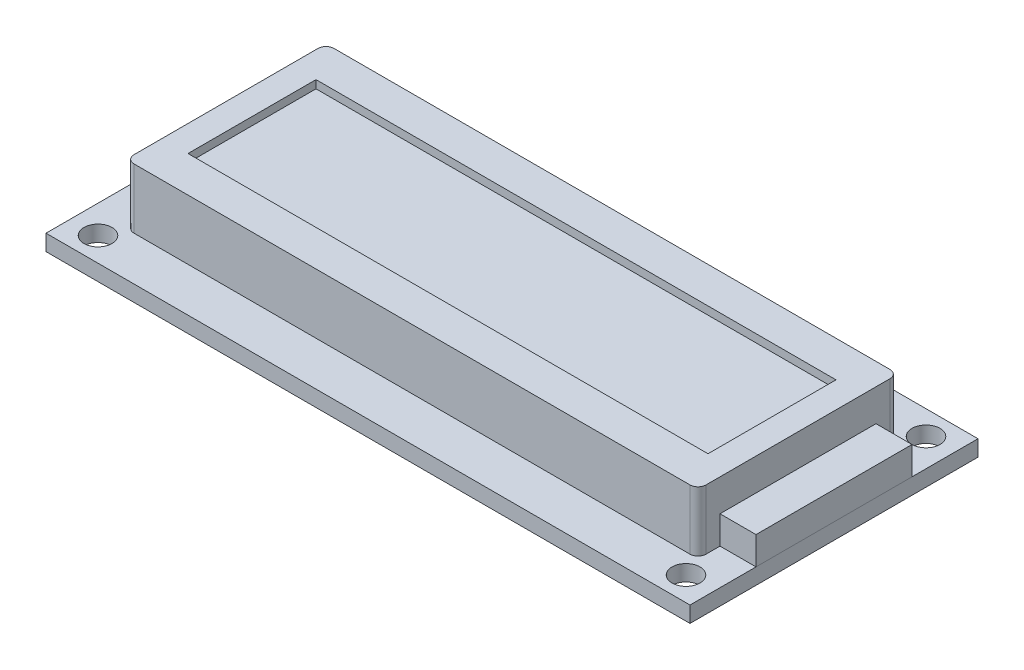
from build123d import *

# Parameters (mm, degrees)
SKETCH1_W                = 80.5
SKETCH1_H                = 36
BOSS_EXTRUDE1_DEPTH      = 2
SKETCH2_R                = 1.75
CUT_EXTRUDE1_DEPTH       = 2
SKETCH3_W                = 71.5
SKETCH3_H                = 25
BOSS_EXTRUDE2_DEPTH      = 7.5
SKETCH4_W                = 65
SKETCH4_H                = 16
CUT_EXTRUDE2_DEPTH       = 1
FILLET1_R                = 1
SKETCH5_W                = 4.5
SKETCH5_H                = 19.5
BOSS_EXTRUDE3_DEPTH      = 3.5
SKETCH6_W                = 19.5
SKETCH6_H                = 3.5
BOSS_EXTRUDE4_DEPTH      = 0.001
BOSS_EXTRUDE5_DEPTH      = 4
BOSS_EXTRUDE5_DEPTH_BACK = 2.5
SKETCH7_R                = 0.3125


with BuildPart() as part:
    # Sketch1 → Boss-Extrude1 (new body)
    with BuildSketch(Plane(origin=(0, 0, 0), x_dir=(1, 0, 0), z_dir=(0, 1, 0))):
        with Locations((-3.238505747, 7.445402299)):
            Rectangle(SKETCH1_W, SKETCH1_H)
    extrude(amount=BOSS_EXTRUDE1_DEPTH)

    # Sketch2 → Cut-Extrude1 (cut)
    with BuildSketch(Plane(origin=(0, 2, 0), x_dir=(1, 0, 0), z_dir=(0, 1, 0))):
        with Locations(Location((-39.988505747, 22.445402299, 0), (0, 0, 270))):
            Circle(SKETCH2_R)
        with Locations(Location((33.511494253, 22.445402299, 0), (0, 0, 270))):
            Circle(SKETCH2_R)
        with Locations(Location((33.511494253, -7.554597701, 0), (0, 0, 270))):
            Circle(SKETCH2_R)
        with Locations(Location((-39.988505747, -7.554597701, 0), (0, 0, 270))):
            Circle(SKETCH2_R)
    extrude(amount=-CUT_EXTRUDE1_DEPTH, mode=Mode.SUBTRACT)

    # Sketch3 → Boss-Extrude2 (add)
    with BuildSketch(Plane(origin=(0, 2, 0), x_dir=(1, 0, 0), z_dir=(0, 1, 0))):
        with Locations((-3.238505747, 7.445402299)):
            Rectangle(SKETCH3_W, SKETCH3_H)
    extrude(amount=BOSS_EXTRUDE2_DEPTH)

    # Sketch4 → Cut-Extrude2 (cut)
    with BuildSketch(Plane(origin=(0, 9.5, 0), x_dir=(1, 0, 0), z_dir=(0, 1, 0))):
        with Locations((-3.238505747, 7.445402299)):
            Rectangle(SKETCH4_W, SKETCH4_H)
    extrude(amount=-CUT_EXTRUDE2_DEPTH, mode=Mode.SUBTRACT)

    # Fillet1
    fillet1_edges = [part.edges().sort_by_distance(p)[0] for p in [
        (-38.988505747, 5.75, -19.945402299),
        (-38.988505747, 5.75, 5.054597701),
        (32.511494253, 5.75, 5.054597701),
        (32.511494253, 5.75, -19.945402299),
    ]]
    fillet(fillet1_edges, radius=FILLET1_R)

    # Sketch5 → Boss-Extrude3 (add)
    with BuildSketch(Plane(origin=(0, 2, 0), x_dir=(1, 0, 0), z_dir=(0, 1, 0))):
        with Locations((34.761494253, 7.445402299)):
            Rectangle(SKETCH5_W, SKETCH5_H)
    extrude(amount=BOSS_EXTRUDE3_DEPTH)

    # Sketch6 → Boss-Extrude4 (add)
    with BuildSketch(Plane(origin=(37.011494253, 0, 0), x_dir=(0, 0, -1), z_dir=(1, 0, 0))):
        with Locations((7.445402299, 3.75)):
            Rectangle(SKETCH6_W, SKETCH6_H)
    extrude(amount=BOSS_EXTRUDE4_DEPTH)

    # Sketch7 → Boss-Extrude5 (add, two sides: drawn at the far end of the back side and taken through both)
    with BuildSketch(Plane(origin=(0, 0, 0), x_dir=(-1, 0, 0), z_dir=(0, -1, 0)).offset(-BOSS_EXTRUDE5_DEPTH_BACK)):
        with Locations(Location((34.988505747, 22.445402299, 0), (0, 0, 90))):
            Circle(SKETCH7_R)
        with Locations(Location((32.488505747, 22.445402299, 0), (0, 0, 90))):
            Circle(SKETCH7_R)
        with Locations(Location((29.988505747, 22.445402299, 0), (0, 0, 90))):
            Circle(SKETCH7_R)
        with Locations(Location((27.488505747, 22.445402299, 0), (0, 0, 90))):
            Circle(SKETCH7_R)
        with Locations(Location((24.988505747, 22.445402299, 0), (0, 0, 90))):
            Circle(SKETCH7_R)
        with Locations(Location((22.488505747, 22.445402299, 0), (0, 0, 90))):
            Circle(SKETCH7_R)
        with Locations(Location((19.988505747, 22.445402299, 0), (0, 0, 90))):
            Circle(SKETCH7_R)
        with Locations(Location((17.488505747, 22.445402299, 0), (0, 0, 90))):
            Circle(SKETCH7_R)
        with Locations(Location((14.988505747, 22.445402299, 0), (0, 0, 90))):
            Circle(SKETCH7_R)
        with Locations(Location((12.488505747, 22.445402299, 0), (0, 0, 90))):
            Circle(SKETCH7_R)
        with Locations(Location((9.988505747, 22.445402299, 0), (0, 0, 90))):
            Circle(SKETCH7_R)
        with Locations(Location((7.488505747, 22.445402299, 0), (0, 0, 90))):
            Circle(SKETCH7_R)
        with Locations(Location((4.988505747, 22.445402299, 0), (0, 0, 90))):
            Circle(SKETCH7_R)
        with Locations(Location((2.488505747, 22.445402299, 0), (0, 0, 90))):
            Circle(SKETCH7_R)
        with Locations(Location((-0.011494253, 22.445402299, 0), (0, 0, 90))):
            Circle(SKETCH7_R)
        with Locations(Location((-2.511494253, 22.445402299, 0), (0, 0, 90))):
            Circle(SKETCH7_R)
    extrude(amount=BOSS_EXTRUDE5_DEPTH + BOSS_EXTRUDE5_DEPTH_BACK)


solid = part.part
